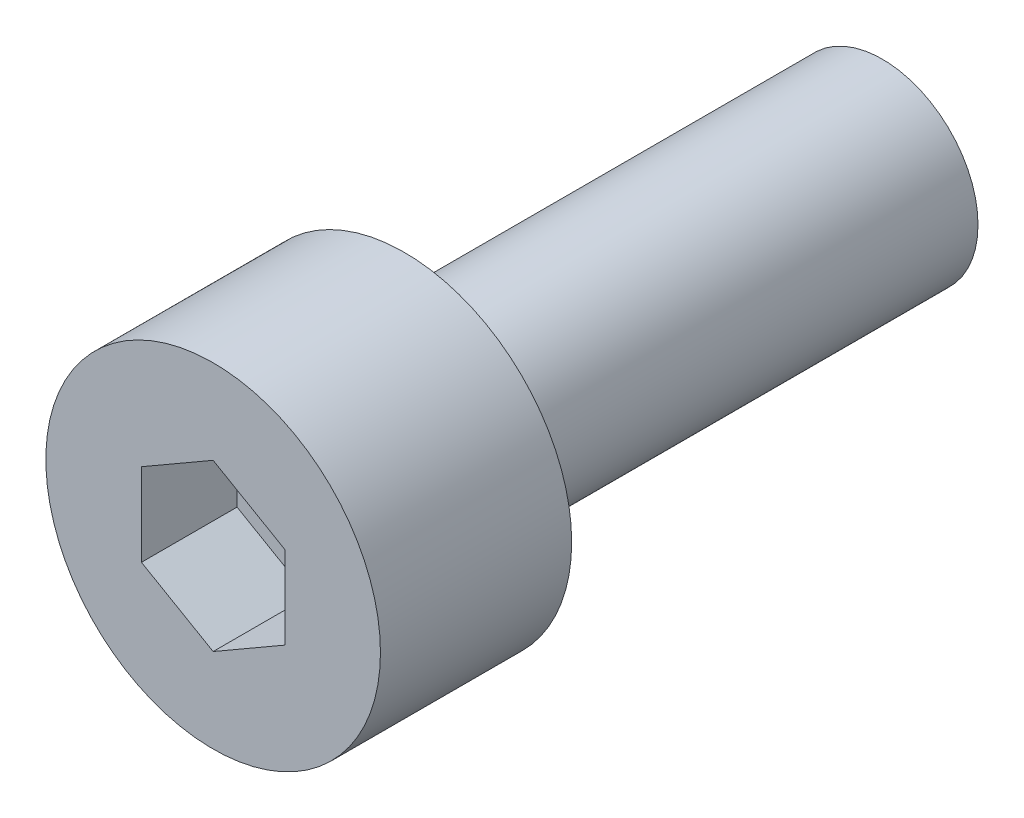
from build123d import *

# Parameters (mm, degrees)
CROQUIS1_R              = 3.5
SALIENTE_EXTRUIR1_DEPTH = 4
CORTAR_EXTRUIR1_DEPTH   = 2
CROQUIS3_R              = 2
SALIENTE_EXTRUIR2_DEPTH = 10


with BuildPart() as part:
    # Croquis1 → Saliente-Extruir1 (new body)
    with BuildSketch(Plane.XY):
        Circle(CROQUIS1_R)
    extrude(amount=SALIENTE_EXTRUIR1_DEPTH)

    # Croquis2 → Cortar-Extruir1 (cut)
    with BuildSketch(Plane.XY.offset(4)):
        Polygon((1.5, 0.866025404), (0, 1.732050808), (-1.5, 0.866025404), (-1.5, -0.866025404), (0, -1.732050808), (1.5, -0.866025404), align=None)
    extrude(amount=-CORTAR_EXTRUIR1_DEPTH, mode=Mode.SUBTRACT)

    # Croquis3 → Saliente-Extruir2 (add)
    with BuildSketch(Plane(origin=(0, 0, 0), x_dir=(-1, 0, 0), z_dir=(0, 0, -1))):
        Circle(CROQUIS3_R)
    extrude(amount=SALIENTE_EXTRUIR2_DEPTH)


solid = part.part
